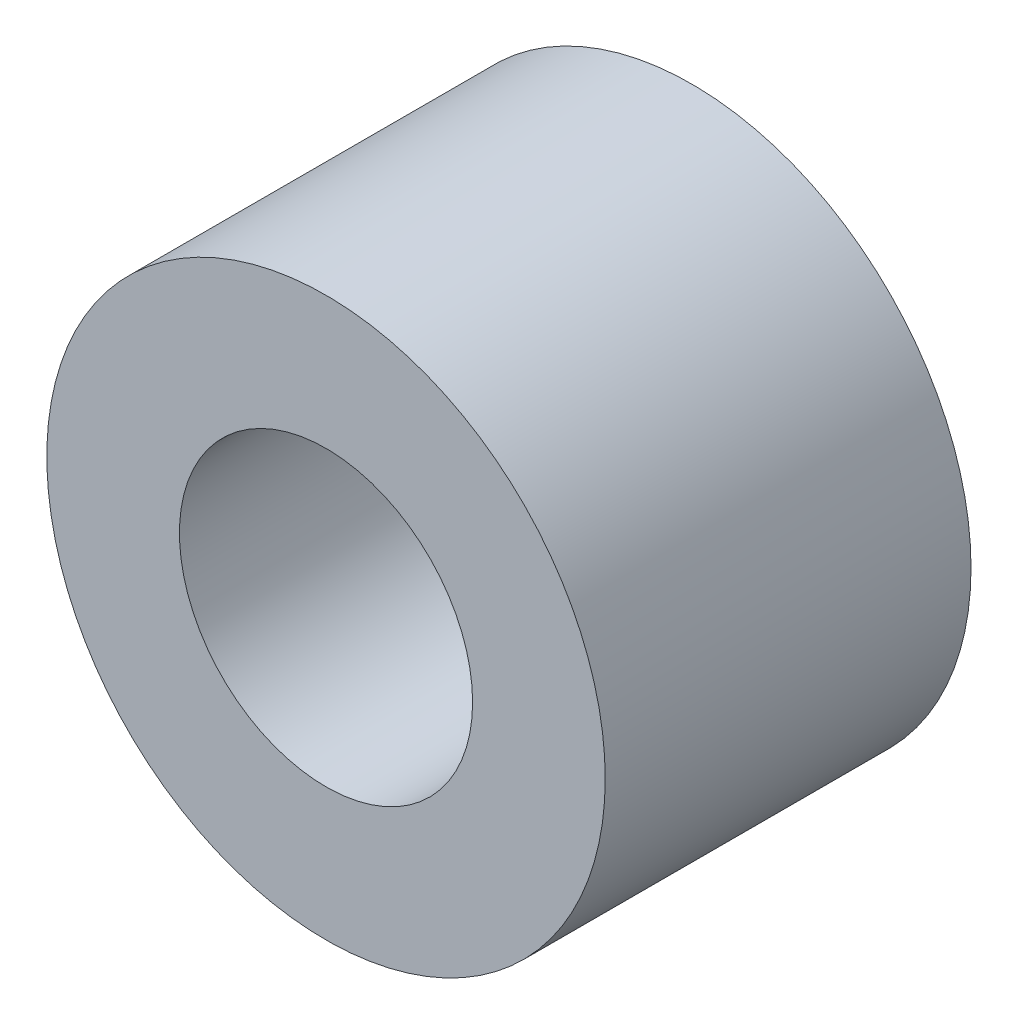
from build123d import *

# Parameters (mm, degrees)
ESQUISSE1_R        = 2
ESQUISSE1_R_2      = 1.05
BOSS_EXTRU_1_DEPTH = 2.62


with BuildPart() as part:
    # Esquisse1 → Boss.-Extru.1 (new body)
    with BuildSketch(Plane.XY):
        Circle(ESQUISSE1_R)
        Circle(ESQUISSE1_R_2, mode=Mode.SUBTRACT)
    extrude(amount=BOSS_EXTRU_1_DEPTH)


solid = part.part
